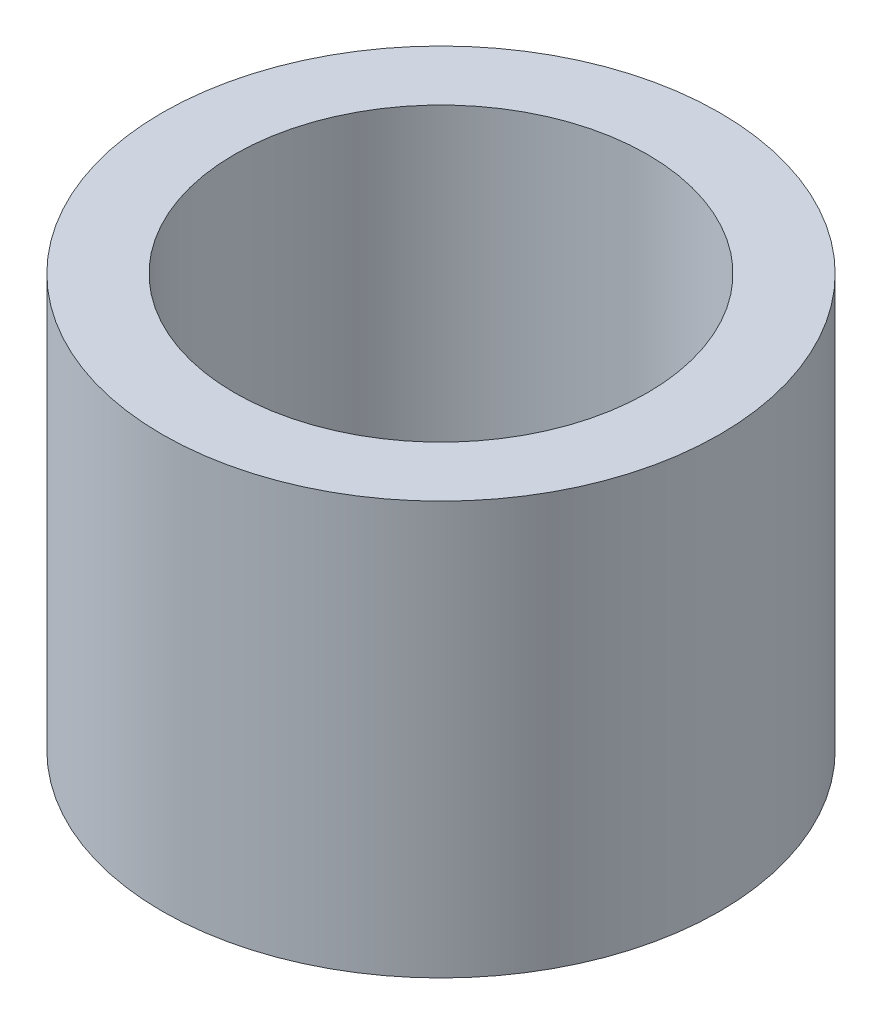
from build123d import *

# Parameters (mm, degrees)
SKETCH_1_R      = 1.35
SKETCH_1_R_2    = 1
EXTRUDE_1_DEPTH = 2


with BuildPart() as part:
    # 草图1 → 凸台-拉伸1 (new body)
    with BuildSketch(Plane(origin=(0, 0, 0), x_dir=(1, 0, 0), z_dir=(0, 1, 0))):
        with Locations(Location((0, 0, 0), (0, 0, 270))):
            Circle(SKETCH_1_R)
        with Locations(Location((0, 0, 0), (0, 0, 270))):
            Circle(SKETCH_1_R_2, mode=Mode.SUBTRACT)
    extrude(amount=EXTRUDE_1_DEPTH)


solid = part.part
